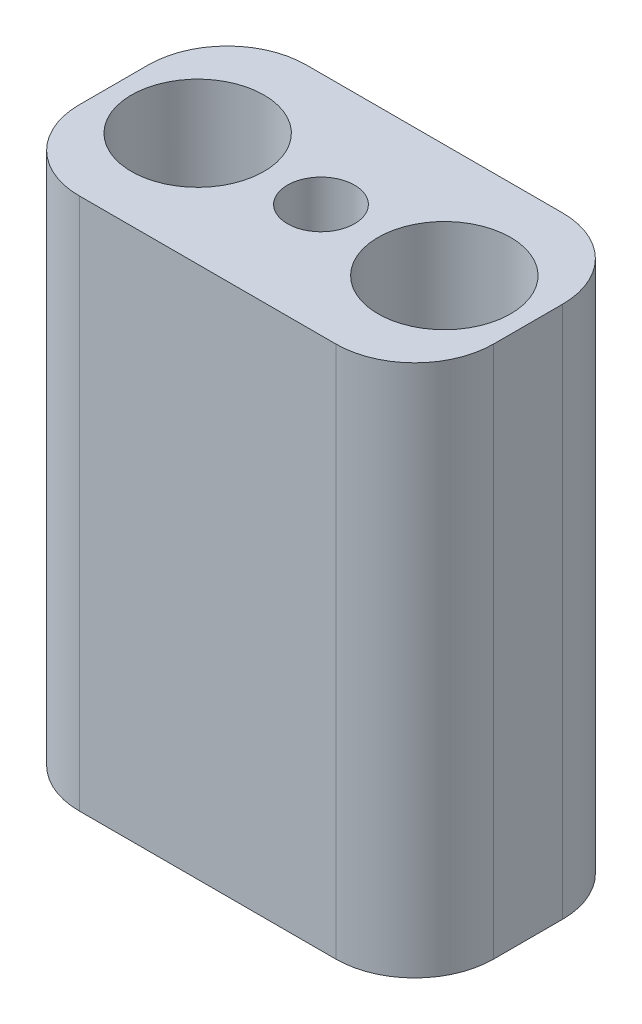
from build123d import *

# Parameters (mm, degrees)
SKETCH1_W                                    = 42
SKETCH1_H                                    = 54
BOSS_EXTRUDE1_DEPTH                          = 23
M8_TAPPED_HOLE1_D                            = 6.8
M8_TAPPED_HOLE1_DEPTH                        = 15
M8_TAPPED_HOLE1_TIP                          = 2.042926105
CSK_FOR_M6_HEX_SOCKET_COUNTERSUNK_CA_2_COUNT = 2
CSK_FOR_M6_HEX_SOCKET_COUNTERSUNK_CA_2_PITCH = 25
FILLET1_R                                    = 8
SKETCH8_R                                    = 6.72
CUT_EXTRUDE1_DEPTH                           = 47.8508271


with BuildPart() as part:
    # Sketch1 → Boss-Extrude1 (new body)
    with BuildSketch(Plane.XY):
        with Locations((0, 27)):
            Rectangle(SKETCH1_W, SKETCH1_H)
    extrude(amount=BOSS_EXTRUDE1_DEPTH)

    # M8 Tapped Hole1
    with Locations(Plane(origin=(0, 54, 0), x_dir=(1, 0, 0), z_dir=(0, 1, 0))):
        with Locations((0, -11.5)):
            Hole(M8_TAPPED_HOLE1_D / 2, depth=M8_TAPPED_HOLE1_DEPTH)
            with Locations((0, 0, -(M8_TAPPED_HOLE1_DEPTH + M8_TAPPED_HOLE1_TIP / 2))):  # 118° drill point
                Cone(0, M8_TAPPED_HOLE1_D / 2, M8_TAPPED_HOLE1_TIP, mode=Mode.SUBTRACT)

    # Sketch5 → CSK for M6 Hex Socket Countersunk Cap Screw2 (revolve, cut)
    with BuildSketch(Plane(origin=(12.5, 35, 11.5), x_dir=(0, 0, 1), z_dir=(1, 0, 0))):
        Polygon((0, 0), (0, 35), (3.3, 35), (3.3, 3.42), (6.72, 0), align=None)
    csk_for_m6_hex_socket_countersunk_cap_sc = revolve(axis=Axis((12.5, 41.35, 11.5), (0, -1, 0)), mode=Mode.SUBTRACT)

    # CSK for M6 Hex Socket Countersunk Ca 2: CSK for M6 Hex Socket Countersunk Cap Screw2 ×2
    with Locations(*[(-i * CSK_FOR_M6_HEX_SOCKET_COUNTERSUNK_CA_2_PITCH, 0, 0) for i in range(1, CSK_FOR_M6_HEX_SOCKET_COUNTERSUNK_CA_2_COUNT)]):
        add(csk_for_m6_hex_socket_countersunk_cap_sc, mode=Mode.SUBTRACT)

    # Fillet1
    fillet1_edges = [part.edges().sort_by_distance(p)[0] for p in [
        (21, 27, 23),
        (-21, 27, 23),
        (21, 27, 0),
        (-21, 27, 0),
    ]]
    fillet(fillet1_edges, radius=FILLET1_R)

    # Sketch8 → Cut-Extrude1 (cut, through all)
    with BuildSketch(Plane(origin=(0, 35, 0), x_dir=(-1, 0, 0), z_dir=(0, -1, 0))):
        with Locations(Location((12.5, -11.5, 0), (0, 0, 90))):
            Circle(SKETCH8_R)
        with Locations(Location((-12.5, -11.5, 0), (0, 0, 90))):
            Circle(SKETCH8_R)
    extrude(amount=-CUT_EXTRUDE1_DEPTH, mode=Mode.SUBTRACT)


solid = part.part
